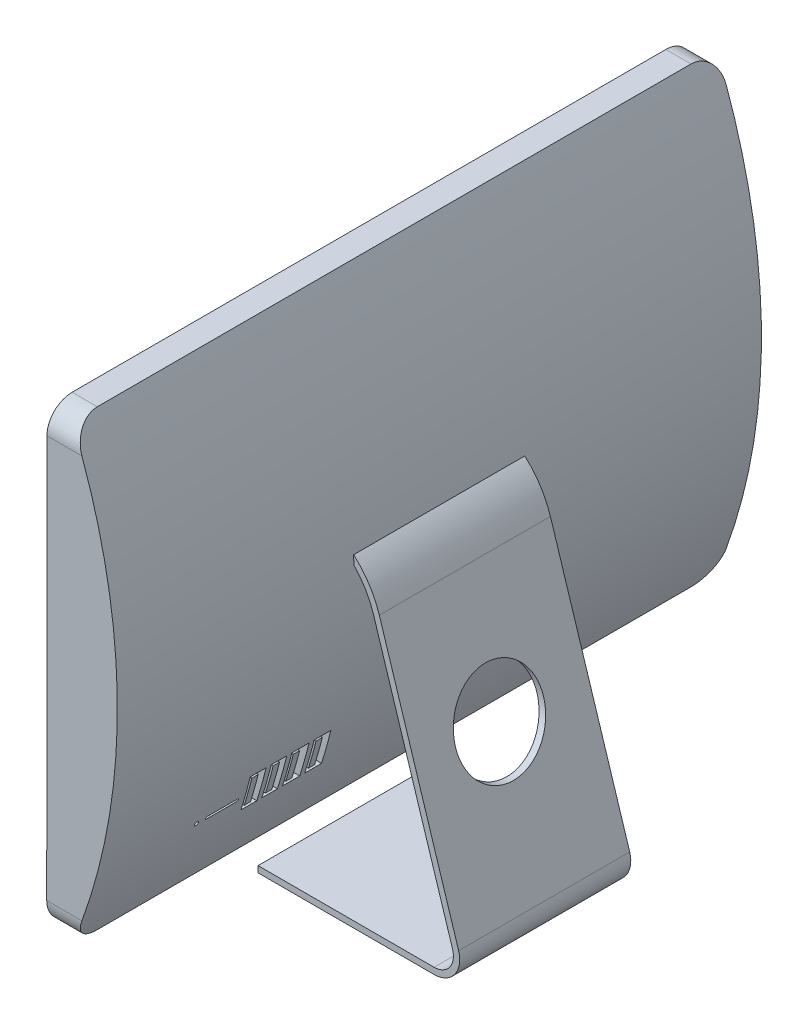
from build123d import *

# Parameters (mm, degrees)
BOSS_EXTRUDE1_DEPTH = 650.24
FILLET1_R           = 25.4
BOSS_EXTRUDE2_DEPTH = 0.254
SKETCH4_W           = 599.44
SKETCH4_H           = 333.15660942
BOSS_EXTRUDE3_DEPTH = 0.00254
BOSS_EXTRUDE4_DEPTH = 86.36
SKETCH6_R           = 44.45
CUT_EXTRUDE1_DEPTH  = 99.568
SKETCH7_W           = 17.431192508
SKETCH7_H           = 33.637597394
SKETCH7_W_2         = 6.35
SKETCH7_H_2         = 27.707593027
SKETCH7_W_3         = 16.902871881
SKETCH7_W_4         = 15.731237492
SKETCH7_W_5         = 16.054307847
SKETCH7_R           = 1.896030158
CUT_EXTRUDE2_DEPTH  = 173.228


with BuildPart() as part:
    # Sketch1 → Boss-Extrude1 (new body)
    with BuildSketch(Plane.XY):
        with BuildLine():
            Line((0, 0), (25.4, 0))
            ThreePointArc((25.4, 0), (71.061606083, 228.6), (25.4, 457.2))
            Line((25.4, 457.2), (0, 457.2))
            Line((0, 457.2), (0, 0))
        make_face()
    extrude(amount=BOSS_EXTRUDE1_DEPTH)

    # Fillet1
    fillet1_edges = [part.edges().sort_by_distance(p)[0] for p in [
        (12.7, 457.2, 650.24),
        (12.7, 457.2, 0),
        (12.7, 0, 0),
        (12.7, 0, 650.24),
    ]]
    fillet(fillet1_edges, radius=FILLET1_R)

    # Sketch2 → Boss-Extrude2 (add)
    with BuildSketch(Plane.ZY):
        with BuildLine():
            Line((0, 69.440928173), (0, 25.4))
            ThreePointArc((0, 25.4), (7.439487758, 7.439487758), (25.4, 0))
            Line((25.4, 0), (624.84, 0))
            ThreePointArc((624.84, 0), (642.800512242, 7.439487758), (650.24, 25.4))
            Line((650.24, 25.4), (650.24, 69.440928173))
            Line((650.24, 69.440928173), (0, 69.440928173))
        make_face()
    extrude(amount=BOSS_EXTRUDE2_DEPTH)

    # Sketch4 → Boss-Extrude3 (add)
    with BuildSketch(Plane.ZY):
        with Locations((325.12, 265.22169529)):
            Rectangle(SKETCH4_W, SKETCH4_H)
    extrude(amount=BOSS_EXTRUDE3_DEPTH)

    # Sketch5 → Boss-Extrude4 (add, symmetric)
    with BuildSketch(Plane.XY.offset(325.12)):
        with BuildLine():
            Line((170.767248261, -51.198725882), (90.734414709, 202.070998511))
            ThreePointArc((90.734414709, 202.070998511), (82.810722474, 219.680826846), (71.027410341, 234.979340102))
            ThreePointArc((71.027410341, 234.979340102), (70.962867279, 239.439815668), (70.86488784, 243.899682046))
            ThreePointArc((70.86488784, 243.899682046), (86.537300589, 225.702245278), (96.789301226, 203.984333103))
            Line((96.789301226, 203.984333103), (176.83835346, -49.336716487))
            ThreePointArc((176.83835346, -49.336716487), (172.803446222, -72.154097904), (152.095027867, -82.55))
            Line((152.095027867, -82.55), (-25.704972133, -82.55))
            Line((-25.704972133, -82.55), (-25.704972133, -76.2))
            Line((-25.704972133, -76.2), (152.095027867, -76.2))
            ThreePointArc((152.095027867, -76.2), (167.697235419, -68.379202467), (170.767248261, -51.198725882))
        make_face()
    extrude(amount=BOSS_EXTRUDE4_DEPTH, both=True)

    # Sketch6 → Cut-Extrude1 (cut)
    with BuildSketch(Plane(origin=(200.66, 0, 0), x_dir=(0, 0, -1), z_dir=(1, 0, 0))):
        with Locations(Location((-327.103881197, 87.189356475, 0), (0, 0, 270))):
            Circle(SKETCH6_R)
    extrude(amount=-CUT_EXTRUDE1_DEPTH, mode=Mode.SUBTRACT)

    # Sketch7 → Cut-Extrude2 (cut)
    # profile 1 of 6: a face of its own
    with BuildSketch(Plane(origin=(200.66, 0, 0), x_dir=(0, 0, -1), z_dir=(1, 0, 0))):
        with Locations((-447.612414344, 67.453463266)):
            Rectangle(SKETCH7_W, SKETCH7_H)
        with Locations((-450.987768144, 67.846432455)):
            Rectangle(SKETCH7_W_2, SKETCH7_H_2, mode=Mode.SUBTRACT)
    # profile 2 of 6: a face of its own
    with BuildSketch(Plane(origin=(200.66, 0, 0), x_dir=(0, 0, -1), z_dir=(1, 0, 0))):
        with Locations((-425.36538215, 67.453463266)):
            Rectangle(SKETCH7_W_3, SKETCH7_H)
        with Locations((-428.061900395, 67.846432455)):
            Rectangle(SKETCH7_W_2, SKETCH7_H_2, mode=Mode.SUBTRACT)
    # profile 3 of 6: a face of its own
    with BuildSketch(Plane(origin=(200.66, 0, 0), x_dir=(0, 0, -1), z_dir=(1, 0, 0))):
        with Locations((-469.273629344, 67.453463266)):
            Rectangle(SKETCH7_W_4, SKETCH7_H)
        with Locations((-471.274687087, 67.846432455)):
            Rectangle(SKETCH7_W_2, SKETCH7_H_2, mode=Mode.SUBTRACT)
    # profile 4 of 6: a face of its own
    with BuildSketch(Plane(origin=(200.66, 0, 0), x_dir=(0, 0, -1), z_dir=(1, 0, 0))):
        with Locations((-490.246402014, 67.453463266)):
            Rectangle(SKETCH7_W_5, SKETCH7_H)
        with Locations((-492.809474486, 67.846432455)):
            Rectangle(SKETCH7_W_2, SKETCH7_H_2, mode=Mode.SUBTRACT)
    # profile 5 of 6: a face of its own
    with BuildSketch(Plane(origin=(200.66, 0, 0), x_dir=(0, 0, -1), z_dir=(1, 0, 0))):
        with BuildLine():
            Line((-506.422738648, 66.642270475), (-537.274582932, 66.642270475))
            ThreePointArc((-537.274582932, 66.642270475), (-538.544582932, 65.372270475), (-537.274582932, 64.102270475))
            Line((-537.274582932, 64.102270475), (-506.422738648, 64.102270475))
            ThreePointArc((-506.422738648, 64.102270475), (-505.152738648, 65.372270475), (-506.422738648, 66.642270475))
        make_face()
    # profile 6 of 6: a face of its own
    with BuildSketch(Plane(origin=(200.66, 0, 0), x_dir=(0, 0, -1), z_dir=(1, 0, 0))):
        with Locations((-547.498439967, 65.372270475)):
            Circle(SKETCH7_R)
    extrude(amount=-CUT_EXTRUDE2_DEPTH, mode=Mode.SUBTRACT)


solid = part.part
